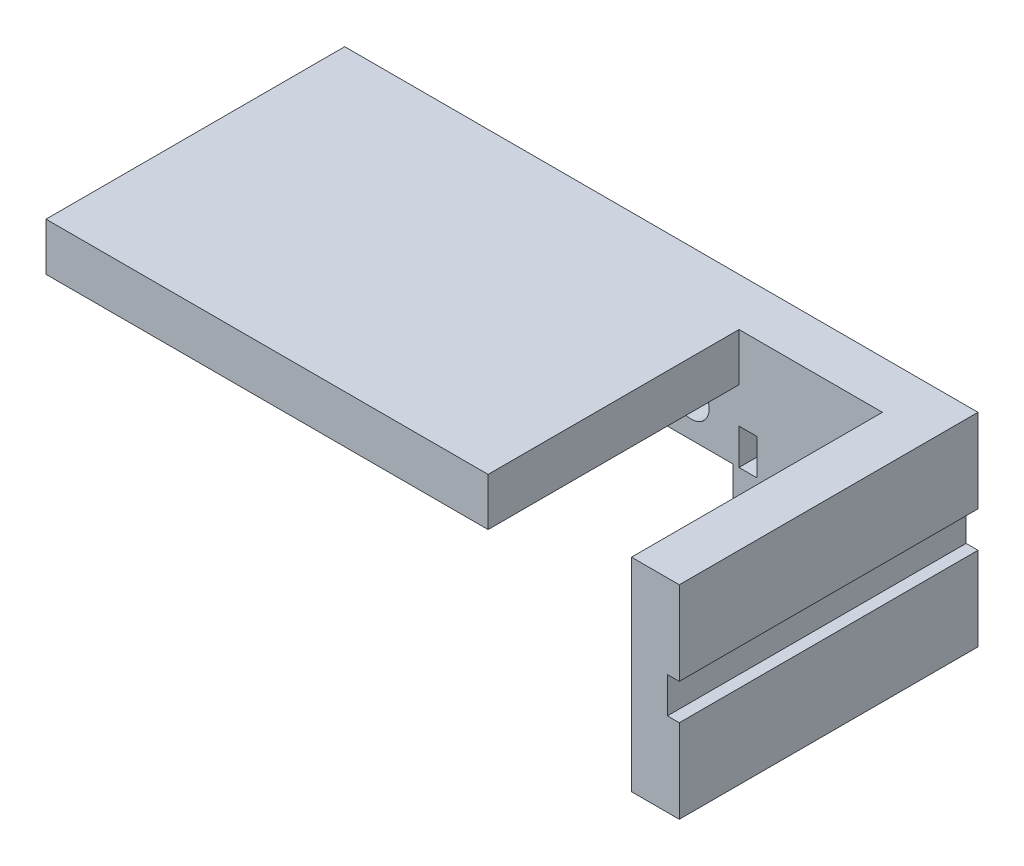
from build123d import *

# Parameters (mm, degrees)
CROQUIS1_W              = 37
CROQUIS1_H              = 10
SALIENTE_EXTRUIR1_DEPTH = 25
CROQUIS2_W              = 37
CROQUIS2_H              = 6
CORTAR_EXTRUIR1_DEPTH   = 21
CROQUIS4_R              = 1.5
CORTAR_EXTRUIR2_DEPTH   = 4
CROQUIS5_W              = 4
CROQUIS5_H              = 10
SALIENTE_EXTRUIR2_DEPTH = 16
CROQUIS6_W              = 4
CROQUIS6_H              = 10
SALIENTE_EXTRUIR3_DEPTH = 21
CROQUIS7_W              = 1.5
CROQUIS7_H              = 3
CORTAR_EXTRUIR3_DEPTH   = 4
SALIENTE_EXTRUIR4_DEPTH = 7
CORTAR_EXTRUIR4_START   = -25
CROQUIS9_W              = 0.995479253
CROQUIS9_H              = 3
CORTAR_EXTRUIR4_DEPTH   = 25


with BuildPart() as part:
    # Croquis1 → Saliente-Extruir1 (new body)
    with BuildSketch(Plane.XY):
        with Locations((-18.845794393, 11.401869159)):
            Rectangle(CROQUIS1_W, CROQUIS1_H)
    extrude(amount=SALIENTE_EXTRUIR1_DEPTH)

    # Croquis2 → Cortar-Extruir1 (cut)
    with BuildSketch(Plane.XY.offset(25)):
        with Locations((-18.845794393, 9.401869159)):
            Rectangle(CROQUIS2_W, CROQUIS2_H)
    extrude(amount=-CORTAR_EXTRUIR1_DEPTH, mode=Mode.SUBTRACT)

    # Croquis4 → Cortar-Extruir2 (cut)
    with BuildSketch(Plane.XY.offset(4)):
        with Locations((-33.345794393, 9.401869159)):
            Circle(CROQUIS4_R)
        with Locations((-4.345794393, 9.401869159)):
            Circle(CROQUIS4_R)
    extrude(amount=-CORTAR_EXTRUIR2_DEPTH, mode=Mode.SUBTRACT)

    # Croquis5 → Saliente-Extruir2 (add)
    with BuildSketch(Plane(origin=(-0.345794393, 0, 0), x_dir=(0, 0, -1), z_dir=(1, 0, 0))):
        with Locations((-2, 11.401869159)):
            Rectangle(CROQUIS5_W, CROQUIS5_H)
    extrude(amount=SALIENTE_EXTRUIR2_DEPTH)

    # Croquis6 → Saliente-Extruir3 (add)
    with BuildSketch(Plane.XY.offset(4)):
        with Locations((13.654205607, 11.401869159)):
            Rectangle(CROQUIS6_W, CROQUIS6_H)
    extrude(amount=SALIENTE_EXTRUIR3_DEPTH)

    # Croquis7 → Cortar-Extruir3 (cut)
    with BuildSketch(Plane.XY.offset(4)):
        with Locations((0.404205607, 7.901869159)):
            Rectangle(CROQUIS7_W, CROQUIS7_H)
    extrude(amount=-CORTAR_EXTRUIR3_DEPTH, mode=Mode.SUBTRACT)

    # Croquis8 → Saliente-Extruir4 (add)
    with BuildSketch(Plane.XZ.offset(-6.401869159)):
        Polygon((11.654205607, 25), (15.654205607, 25), (15.654205607, 0), (-0.845794393, 0), (-0.845794393, 4), (11.654205607, 4), align=None)
    extrude(amount=SALIENTE_EXTRUIR4_DEPTH)

    # Croquis9 → Cortar-Extruir4 (cut)
    with BuildSketch(Plane(origin=(0, 0, 0), x_dir=(-1, 0, 0), z_dir=(0, 0, -1)).offset(CORTAR_EXTRUIR4_START)):
        with Locations((-15.156465981, 7.901869159)):
            Rectangle(CROQUIS9_W, CROQUIS9_H)
    extrude(amount=CORTAR_EXTRUIR4_DEPTH, mode=Mode.SUBTRACT)


solid = part.part
